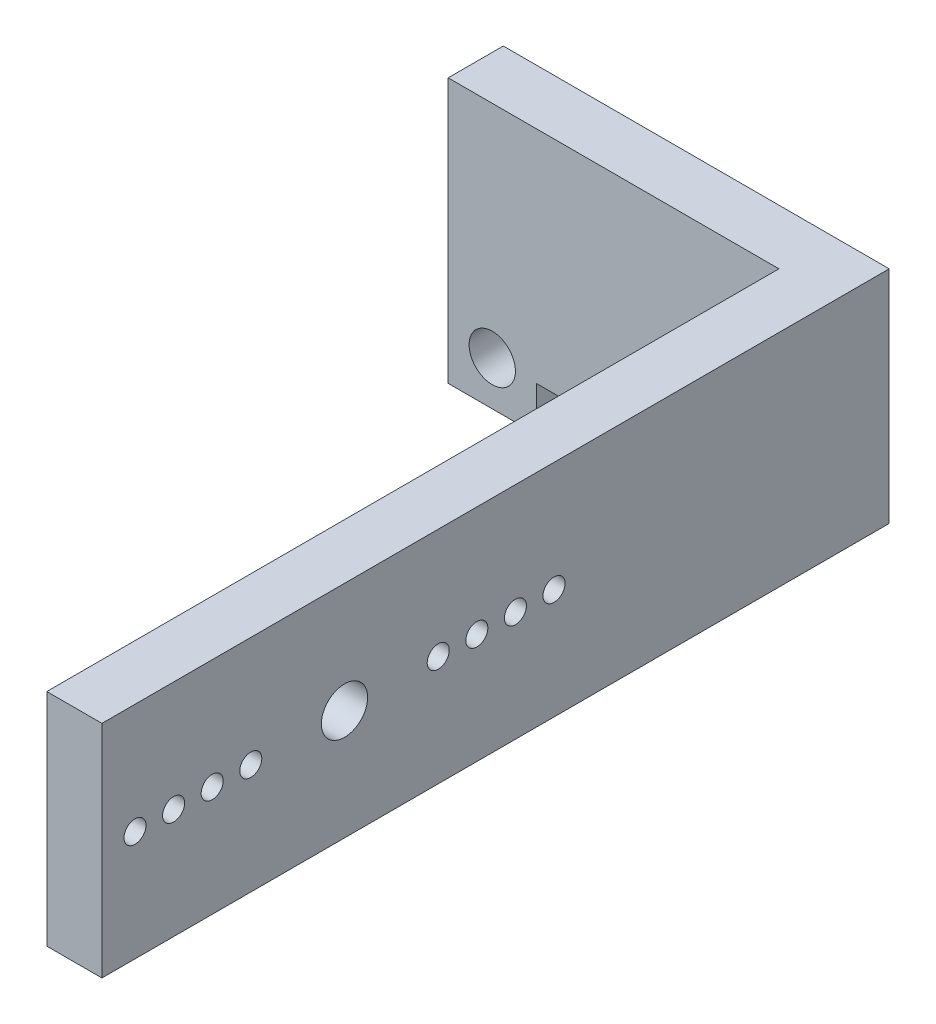
from build123d import *

# Parameters (mm, degrees)
CROQUIS1_R              = 2.1
SALIENTE_EXTRUIR1_DEPTH = 5
CROQUIS2_W              = 71.4
CROQUIS2_H              = 20
CROQUIS2_R              = 2.1
SALIENTE_EXTRUIR2_DEPTH = 5
CORTAR_EXTRUIR1_REACH   = 83.994
CROQUIS4_R              = 1
CORTAR_EXTRUIR2_START   = -5
CROQUIS5_R              = 2.1
CORTAR_EXTRUIR2_DEPTH   = 3


with BuildPart() as part:
    # Croquis1 → Saliente-Extruir1 (new body)
    with BuildSketch(Plane.XY):
        Polygon((26, 20), (-4, 20), (-4, -4), (4, -4), (4, 0), (26, 0), align=None)
        Circle(CROQUIS1_R, mode=Mode.SUBTRACT)
    extrude(amount=SALIENTE_EXTRUIR1_DEPTH)

    # Croquis2 → Saliente-Extruir2 (add)
    with BuildSketch(Plane(origin=(26, 0, 0), x_dir=(0, 0, -1), z_dir=(1, 0, 0))):
        with Locations((-35.7, 10)):
            Rectangle(CROQUIS2_W, CROQUIS2_H)
        with Locations((-49.4, 10)):
            Circle(CROQUIS2_R, mode=Mode.SUBTRACT)
    extrude(amount=SALIENTE_EXTRUIR2_DEPTH)

    # Croquis4 → Cortar-Extruir1 (cut, up to next)
    with BuildSketch(Plane(origin=(31, 0, 0), x_dir=(0, 0, -1), z_dir=(1, 0, 0)), mode=Mode.PRIVATE) as cortar_extruir1_sk1:
        with Locations((-68.4, 10)):
            Circle(CROQUIS4_R)
    cortar_extruir1_tool1 = extrude(cortar_extruir1_sk1.sketch, amount=-CORTAR_EXTRUIR1_REACH, mode=Mode.PRIVATE) & part.part
    # Croquis4 → Cortar-Extruir1 (cut, up to next)
    with BuildSketch(Plane(origin=(31, 0, 0), x_dir=(0, 0, -1), z_dir=(1, 0, 0)), mode=Mode.PRIVATE) as cortar_extruir1_sk2:
        with Locations((-64.9, 10)):
            Circle(CROQUIS4_R)
    cortar_extruir1_tool2 = extrude(cortar_extruir1_sk2.sketch, amount=-CORTAR_EXTRUIR1_REACH, mode=Mode.PRIVATE) & part.part
    # Croquis4 → Cortar-Extruir1 (cut, up to next)
    with BuildSketch(Plane(origin=(31, 0, 0), x_dir=(0, 0, -1), z_dir=(1, 0, 0)), mode=Mode.PRIVATE) as cortar_extruir1_sk3:
        with Locations((-61.4, 10)):
            Circle(CROQUIS4_R)
    cortar_extruir1_tool3 = extrude(cortar_extruir1_sk3.sketch, amount=-CORTAR_EXTRUIR1_REACH, mode=Mode.PRIVATE) & part.part
    # Croquis4 → Cortar-Extruir1 (cut, up to next)
    with BuildSketch(Plane(origin=(31, 0, 0), x_dir=(0, 0, -1), z_dir=(1, 0, 0)), mode=Mode.PRIVATE) as cortar_extruir1_sk4:
        with Locations((-57.9, 10)):
            Circle(CROQUIS4_R)
    cortar_extruir1_tool4 = extrude(cortar_extruir1_sk4.sketch, amount=-CORTAR_EXTRUIR1_REACH, mode=Mode.PRIVATE) & part.part
    # Croquis4 → Cortar-Extruir1 (cut, up to next)
    with BuildSketch(Plane(origin=(31, 0, 0), x_dir=(0, 0, -1), z_dir=(1, 0, 0)), mode=Mode.PRIVATE) as cortar_extruir1_sk5:
        with Locations((-40.9, 10)):
            Circle(CROQUIS4_R)
    cortar_extruir1_tool5 = extrude(cortar_extruir1_sk5.sketch, amount=-CORTAR_EXTRUIR1_REACH, mode=Mode.PRIVATE) & part.part
    # Croquis4 → Cortar-Extruir1 (cut, up to next)
    with BuildSketch(Plane(origin=(31, 0, 0), x_dir=(0, 0, -1), z_dir=(1, 0, 0)), mode=Mode.PRIVATE) as cortar_extruir1_sk6:
        with Locations((-37.4, 10)):
            Circle(CROQUIS4_R)
    cortar_extruir1_tool6 = extrude(cortar_extruir1_sk6.sketch, amount=-CORTAR_EXTRUIR1_REACH, mode=Mode.PRIVATE) & part.part
    # Croquis4 → Cortar-Extruir1 (cut, up to next)
    with BuildSketch(Plane(origin=(31, 0, 0), x_dir=(0, 0, -1), z_dir=(1, 0, 0)), mode=Mode.PRIVATE) as cortar_extruir1_sk7:
        with Locations((-33.9, 10)):
            Circle(CROQUIS4_R)
    cortar_extruir1_tool7 = extrude(cortar_extruir1_sk7.sketch, amount=-CORTAR_EXTRUIR1_REACH, mode=Mode.PRIVATE) & part.part
    # Croquis4 → Cortar-Extruir1 (cut, up to next)
    with BuildSketch(Plane(origin=(31, 0, 0), x_dir=(0, 0, -1), z_dir=(1, 0, 0)), mode=Mode.PRIVATE) as cortar_extruir1_sk8:
        with Locations((-30.4, 10)):
            Circle(CROQUIS4_R)
    cortar_extruir1_tool8 = extrude(cortar_extruir1_sk8.sketch, amount=-CORTAR_EXTRUIR1_REACH, mode=Mode.PRIVATE) & part.part
    add(cortar_extruir1_tool1.solids().sort_by_distance((31, 10, 68.4))[0], mode=Mode.SUBTRACT)
    add(cortar_extruir1_tool2.solids().sort_by_distance((31, 10, 64.9))[0], mode=Mode.SUBTRACT)
    add(cortar_extruir1_tool3.solids().sort_by_distance((31, 10, 61.4))[0], mode=Mode.SUBTRACT)
    add(cortar_extruir1_tool4.solids().sort_by_distance((31, 10, 57.9))[0], mode=Mode.SUBTRACT)
    add(cortar_extruir1_tool5.solids().sort_by_distance((31, 10, 40.9))[0], mode=Mode.SUBTRACT)
    add(cortar_extruir1_tool6.solids().sort_by_distance((31, 10, 37.4))[0], mode=Mode.SUBTRACT)
    add(cortar_extruir1_tool7.solids().sort_by_distance((31, 10, 33.9))[0], mode=Mode.SUBTRACT)
    add(cortar_extruir1_tool8.solids().sort_by_distance((31, 10, 30.4))[0], mode=Mode.SUBTRACT)

    # Croquis5 → Cortar-Extruir2 (cut)
    with BuildSketch(Plane(origin=(31, 0, 0), x_dir=(0, 0, -1), z_dir=(1, 0, 0)).offset(CORTAR_EXTRUIR2_START)):
        with Locations((-57.9, 10)):
            Circle(CROQUIS5_R)
        with Locations((-64.9, 10)):
            Circle(CROQUIS5_R)
        with Locations((-40.9, 10)):
            Circle(CROQUIS5_R)
        with Locations((-33.9, 10)):
            Circle(CROQUIS5_R)
    extrude(amount=CORTAR_EXTRUIR2_DEPTH, mode=Mode.SUBTRACT)


solid = part.part
